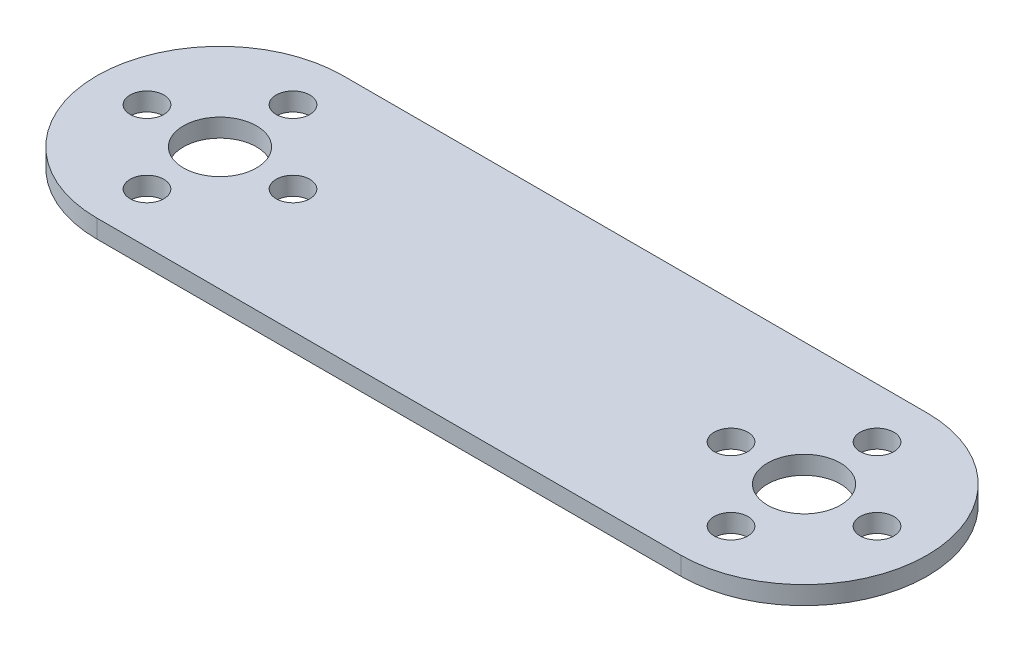
from build123d import *

# Parameters (mm, degrees)
SKETCH1_W                 = 91
SKETCH1_H                 = 27
EXTRUDE1_DEPTH            = 1
FILLET1_RADIUS            = 13.5
FILLET1_LENGTH            = 2
FILLET3_RADIUS            = 13.5
FILLET3_LENGTH            = 2
SKETCH2_R                 = 4
SKETCH2_R_2               = 1.85
CUT_EXTRUDE1_DEPTH        = 2
CIRPATTERN1_COUNT         = 4
MIRROR2_COPY_1_SKETCH_R   = 4
MIRROR2_COPY_1_SKETCH_R_2 = 1.85
MIRROR2_COPY_1_DEPTH      = 2
MIRROR2_COPY_2_SKETCH_R   = 4
MIRROR2_COPY_2_SKETCH_R_2 = 1.85
MIRROR2_COPY_2_DEPTH      = 2
MIRROR2_COPY_3_SKETCH_R   = 4
MIRROR2_COPY_3_SKETCH_R_2 = 1.85
MIRROR2_COPY_3_DEPTH      = 2


with BuildPart() as part:
    # Sketch1 → Extrude1 (new, symmetric)
    with BuildSketch(Plane(origin=(0, 0, 0), x_dir=(1, 0, 0), z_dir=(0, 1, 0))):
        Rectangle(SKETCH1_W, SKETCH1_H)
    extrude(amount=EXTRUDE1_DEPTH, both=True)

    # Fillet1: full round fillet: the end face becomes a half cylinder, R = half its width
    fillet1_face = Plane((-45.5, 0, 0), x_dir=(0, -1, 0), z_dir=(-1, 0, 0))  # on the end face: x along it, z out of the body
    fillet1_slab = fillet1_face.offset(-FILLET1_RADIUS / 2) * Box(FILLET1_LENGTH, 2 * FILLET1_RADIUS, FILLET1_RADIUS, mode=Mode.PRIVATE)  # the body's end, R deep
    fillet1_round = Plane((-32, 0, 0), x_dir=(-1, 0, 0), z_dir=(0, -1, 0)) * Cylinder(FILLET1_RADIUS, FILLET1_LENGTH, mode=Mode.PRIVATE)  # its axis R under the face
    add(fillet1_slab - fillet1_round, mode=Mode.SUBTRACT)

    # Fillet3: full round fillet: the end face becomes a half cylinder, R = half its width
    fillet3_face = Plane((45.5, 0, 0), x_dir=(0, 1, 0), z_dir=(1, 0, 0))  # on the end face: x along it, z out of the body
    fillet3_slab = fillet3_face.offset(-FILLET3_RADIUS / 2) * Box(FILLET3_LENGTH, 2 * FILLET3_RADIUS, FILLET3_RADIUS, mode=Mode.PRIVATE)  # the body's end, R deep
    fillet3_round = Plane((32, 0, 0), x_dir=(1, 0, 0), z_dir=(0, 1, 0)) * Cylinder(FILLET3_RADIUS, FILLET3_LENGTH, mode=Mode.PRIVATE)  # its axis R under the face
    add(fillet3_slab - fillet3_round, mode=Mode.SUBTRACT)

    # Sketch2 → Cut-Extrude1 (cut)
    with BuildSketch(Plane(origin=(0, 1, 0), x_dir=(1, 0, 0), z_dir=(0, 1, 0))):
        with Locations(Location((-32, 0, 0), (0, 0, 270))):
            Circle(SKETCH2_R)
        with Locations(Location((-24, 0, 0), (0, 0, 270))):
            Circle(SKETCH2_R_2)
    cut_extrude1 = extrude(amount=-CUT_EXTRUDE1_DEPTH, mode=Mode.SUBTRACT)

    # CirPattern1: Cut-Extrude1 ×4 about axis
    cirpattern1_axis = Axis((-32, 0, 0), (0, 1, 0))
    for i in range(1, CIRPATTERN1_COUNT):
        add(cut_extrude1.rotate(cirpattern1_axis, i * 360 / CIRPATTERN1_COUNT), mode=Mode.SUBTRACT)

    # Mirror2: Cut-Extrude1 across plane
    add(cut_extrude1.mirror(Plane(origin=(0, 0, 0), x_dir=(0, 0, 1), z_dir=(1, 0, 0))), mode=Mode.SUBTRACT)

    # Mirror2 copy 1 sketch → Mirror2 copy 1 (cut)
    with BuildSketch(Plane(origin=(32, 1, -32), x_dir=(0, 0, -1), z_dir=(0, 1, 0))):
        with Locations((-32, 0)):
            Circle(MIRROR2_COPY_1_SKETCH_R)
        with Locations((-24, 0)):
            Circle(MIRROR2_COPY_1_SKETCH_R_2)
    extrude(amount=-MIRROR2_COPY_1_DEPTH, mode=Mode.SUBTRACT)

    # Mirror2 copy 2 sketch → Mirror2 copy 2 (cut)
    with BuildSketch(Plane(origin=(64, 1, 0), x_dir=(1, 0, 0), z_dir=(0, 1, 0))):
        with Locations((-32, 0)):
            Circle(MIRROR2_COPY_2_SKETCH_R)
        with Locations((-24, 0)):
            Circle(MIRROR2_COPY_2_SKETCH_R_2)
    extrude(amount=-MIRROR2_COPY_2_DEPTH, mode=Mode.SUBTRACT)

    # Mirror2 copy 3 sketch → Mirror2 copy 3 (cut)
    with BuildSketch(Plane(origin=(32, 1, 32), x_dir=(0, 0, 1), z_dir=(0, 1, 0))):
        with Locations((-32, 0)):
            Circle(MIRROR2_COPY_3_SKETCH_R)
        with Locations((-24, 0)):
            Circle(MIRROR2_COPY_3_SKETCH_R_2)
    extrude(amount=-MIRROR2_COPY_3_DEPTH, mode=Mode.SUBTRACT)


solid = part.part
